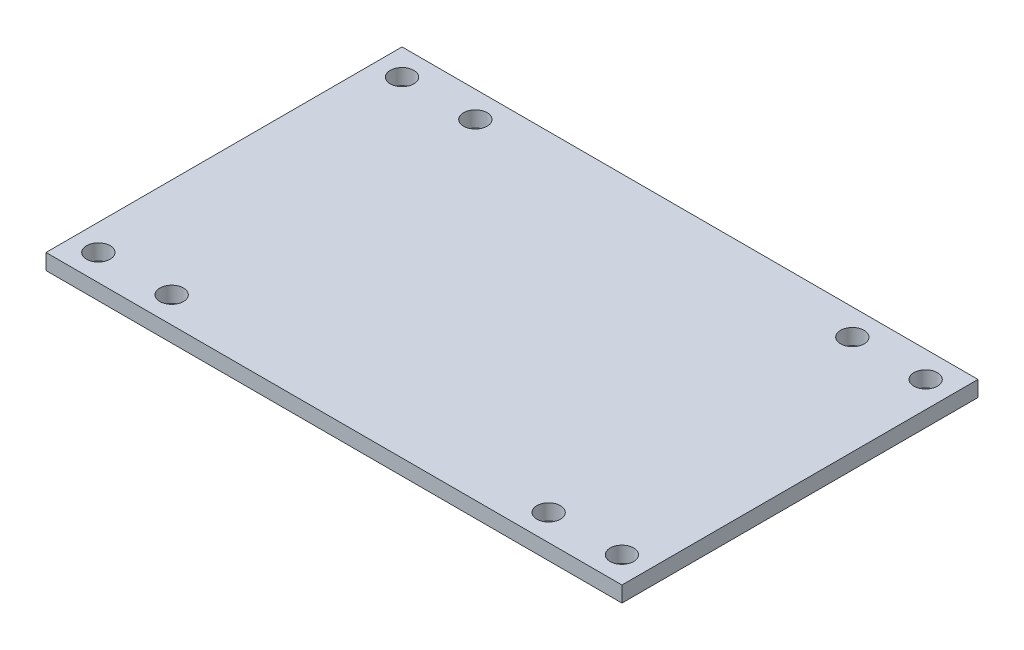
from build123d import *

# Parameters (mm, degrees)
SKETCH1_W           = 55
SKETCH1_H           = 34
BOSS_EXTRUDE1_DEPTH = 1.5
SKETCH3_R           = 1.125
CUT_EXTRUDE5_DEPTH  = 33.365104665


with BuildPart() as part:
    # Sketch1 → Boss-Extrude1 (new body)
    with BuildSketch(Plane(origin=(0, 0, 0), x_dir=(1, 0, 0), z_dir=(0, 1, 0))):
        Rectangle(SKETCH1_W, SKETCH1_H)
    extrude(amount=BOSS_EXTRUDE1_DEPTH)

    # Sketch3 → Cut-Extrude5 (cut, through all)
    with BuildSketch(Plane(origin=(0, 0, 0), x_dir=(1, 0, 0), z_dir=(0, 1, 0))):
        with Locations(Location((-18, 14.5, 0), (0, 0, 270))):
            Circle(SKETCH3_R)
        with Locations(Location((18, 14.5, 0), (0, 0, 270))):
            Circle(SKETCH3_R)
        with Locations(Location((-18, -14.5, 0), (0, 0, 270))):
            Circle(SKETCH3_R)
        with Locations(Location((18, -14.5, 0), (0, 0, 270))):
            Circle(SKETCH3_R)
        with Locations(Location((-25, 14.5, 0), (0, 0, 270))):
            Circle(SKETCH3_R)
        with Locations(Location((25, 14.5, 0), (0, 0, 270))):
            Circle(SKETCH3_R)
        with Locations(Location((25, -14.5, 0), (0, 0, 270))):
            Circle(SKETCH3_R)
        with Locations(Location((-25, -14.5, 0), (0, 0, 270))):
            Circle(SKETCH3_R)
    extrude(amount=CUT_EXTRUDE5_DEPTH, mode=Mode.SUBTRACT)


solid = part.part
